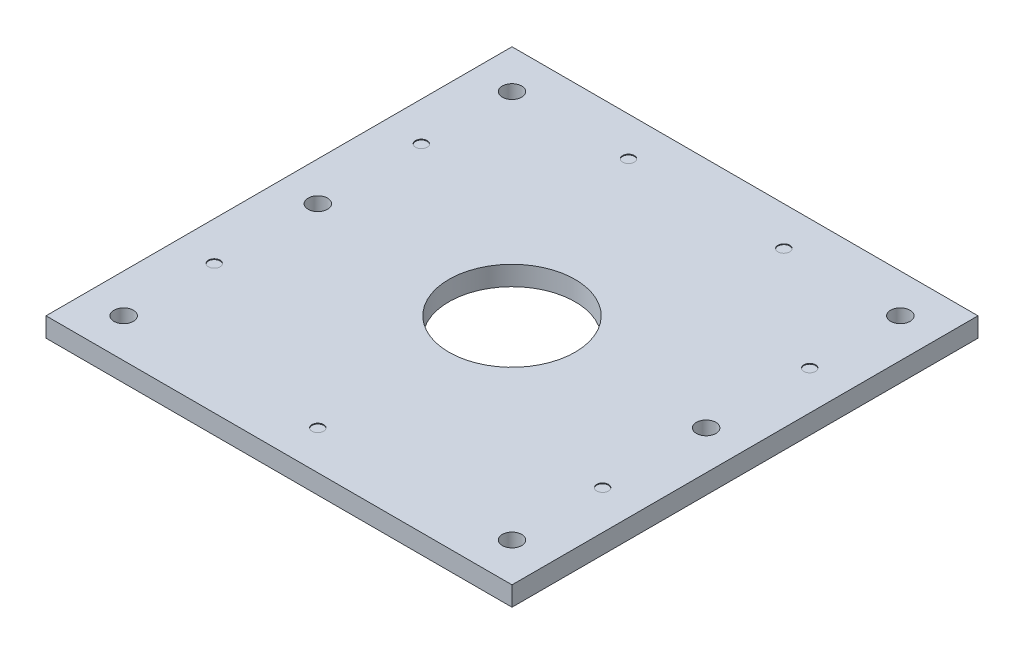
from build123d import *

# Parameters (mm, degrees)
SKETCH3_W           = 152.4
SKETCH3_H           = 6.35
BOSS_EXTRUDE1_DEPTH = 76.2
SKETCH4_R           = 3.175
CUT_EXTRUDE1_DEPTH  = 108.95
SKETCH5_R           = 1.905
SKETCH5_R_2         = 3.175
CUT_EXTRUDE2_DEPTH  = 0.254
SKETCH6_R           = 20.6375
CUT_EXTRUDE3_DEPTH  = 108.95


with BuildPart() as part:
    # Sketch3 → Boss-Extrude1 (new, symmetric)
    with BuildSketch(Plane.XY):
        Rectangle(SKETCH3_W, SKETCH3_H)
    extrude(amount=BOSS_EXTRUDE1_DEPTH, both=True)

    # Sketch4 → Cut-Extrude1 (cut, through all)
    with BuildSketch(Plane(origin=(0, 3.175, 0), x_dir=(1, 0, 0), z_dir=(0, 1, 0))):
        with Locations(Location((-63.5, 63.5, 0), (0, 0, 270))):
            Circle(SKETCH4_R)
        with Locations(Location((63.5, 63.5, 0), (0, 0, 270))):
            Circle(SKETCH4_R)
        with Locations(Location((63.5, 0, 0), (0, 0, 270))):
            Circle(SKETCH4_R)
        with Locations(Location((63.5, -63.5, 0), (0, 0, 270))):
            Circle(SKETCH4_R)
        with Locations(Location((-63.5, -63.5, 0), (0, 0, 270))):
            Circle(SKETCH4_R)
        with Locations(Location((-63.5, 0, 0), (0, 0, 270))):
            Circle(SKETCH4_R)
    extrude(amount=-CUT_EXTRUDE1_DEPTH, mode=Mode.SUBTRACT)

    # Sketch5 → Cut-Extrude2 (cut)
    with BuildSketch(Plane(origin=(0, 3.175, 0), x_dir=(1, 0, 0), z_dir=(0, 1, 0))):
        with Locations(Location((-25.4, 63.5, 0), (0, 0, 270))):
            Circle(SKETCH5_R)
        with Locations(Location((25.4, 63.5, 0), (0, 0, 270))):
            Circle(SKETCH5_R)
        with Locations(Location((63.5, 33.866666667, 0), (0, 0, 270))):
            Circle(SKETCH5_R)
        with Locations(Location((63.5, -33.866666667, 0), (0, 0, 270))):
            Circle(SKETCH5_R)
        with Locations(Location((0, -63.5, 0), (0, 0, 270))):
            Circle(SKETCH5_R)
        with Locations(Location((-63.5, -33.866666667, 0), (0, 0, 270))):
            Circle(SKETCH5_R)
        with Locations(Location((-63.5, 33.866666667, 0), (0, 0, 270))):
            Circle(SKETCH5_R)
        with Locations(Location((63.5, -63.5, 0), (0, 0, 270))):
            Circle(SKETCH5_R_2)
        with Locations(Location((-63.5, 63.5, 0), (0, 0, 270))):
            Circle(SKETCH5_R_2)
    extrude(amount=-CUT_EXTRUDE2_DEPTH, mode=Mode.SUBTRACT)

    # Sketch6 → Cut-Extrude3 (cut, through all)
    with BuildSketch(Plane(origin=(0, 3.175, 0), x_dir=(1, 0, 0), z_dir=(0, 1, 0))):
        with Locations(Location((0, 0, 0), (0, 0, 270))):
            Circle(SKETCH6_R)
    extrude(amount=-CUT_EXTRUDE3_DEPTH, mode=Mode.SUBTRACT)


solid = part.part
